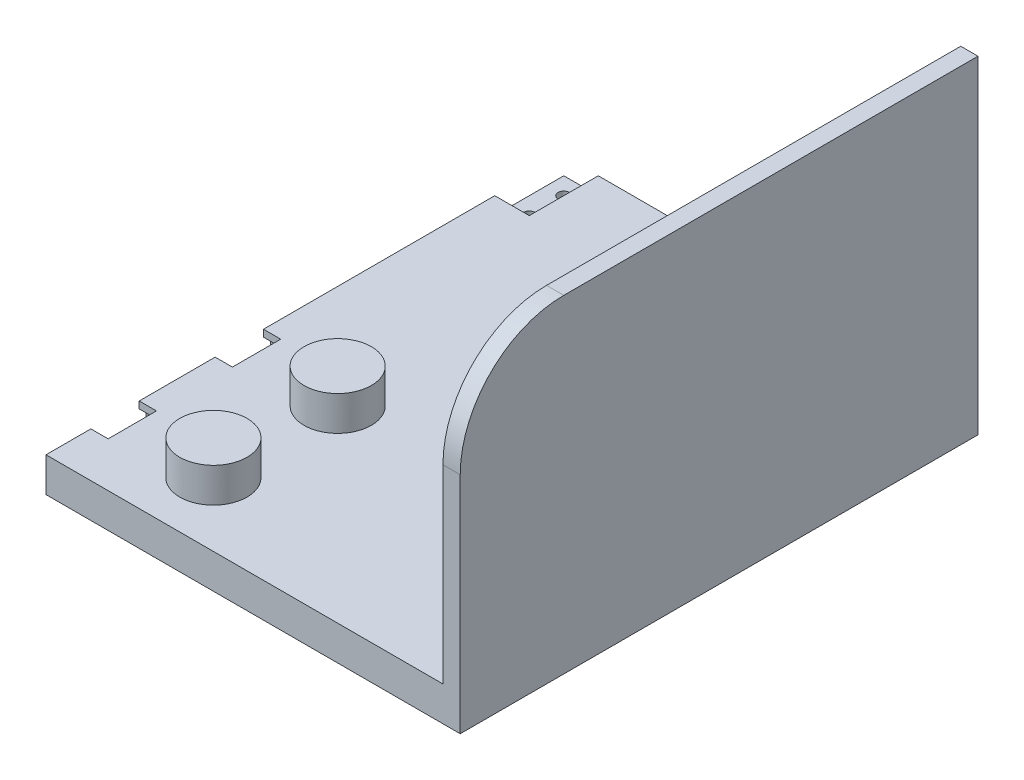
from build123d import *

# Parameters (mm, degrees)
SKETCH_1_W           = 120
SKETCH_1_H           = 95
EXTRUDE_1_DEPTH      = 150
SKETCH_2_W           = 115
SKETCH_2_H           = 85
CUT_EXTRUDE_1_DEPTH  = 150
CUT_EXTRUDE_2_DEPTH  = 150
SKETCH_5_W           = 10
SKETCH_5_H           = 35
SKETCH_5_R           = 1.65
EXTRUDE_2_DEPTH      = 5
EXTRUDE_START        = -33
EXTRUDE_3_DEPTH      = 3
EXTRUDE_START_2      = 52
EXTRUDE_4_DEPTH      = 3
SKETCH_8_W           = 10
SKETCH_8_H           = 20
SKETCH_8_R           = 1.65
CUT_EXTRUDE_3_DEPTH  = 5
SKETCH_10_R          = 1.65
CUT_EXTRUDE_4_DEPTH  = 195.788985905
SKETCH_22_R          = 7.75
CUT_EXTRUDE_8_DEPTH  = 199.407311022
SKETCH_24_R          = 9.75
SKETCH_24_R_2        = 7.75
EXTRUDE_7_DEPTH      = 15
SKETCH_26_R          = 9.75
EXTRUDE_8_DEPTH      = 5
SKETCH_31_W          = 40.5
SKETCH_31_H          = 21
CUT_EXTRUDE_11_DEPTH = 8
SKETCH_32_W          = 5
SKETCH_32_H          = 14
CUT_EXTRUDE_12_DEPTH = 200.355835204
SKETCH_33_W          = 55
SKETCH_33_H          = 55
CUT_EXTRUDE_13_DEPTH = 1
EXTRUDE_9_DEPTH      = 5


with BuildPart() as part:
    # 草图1 → 凸台-拉伸1 (new body)
    with BuildSketch(Plane.XY):
        with Locations((30.651801029, 11.329331046)):
            Rectangle(SKETCH_1_W, SKETCH_1_H)
    extrude(amount=EXTRUDE_1_DEPTH)

    # 草图2 → 切除-拉伸1 (cut)
    with BuildSketch(Plane.XY.offset(150)):
        with Locations((28.151801029, 16.329331046)):
            Rectangle(SKETCH_2_W, SKETCH_2_H)
    extrude(amount=-CUT_EXTRUDE_1_DEPTH, mode=Mode.SUBTRACT)

    # 草图3 → 切除-拉伸2 (cut)
    with BuildSketch(Plane(origin=(90.651801029, 0, 0), x_dir=(0, 0, -1), z_dir=(1, 0, 0))):
        Polygon((-150, 58.829331046), (-150, -26.170668954), (0, 58.829331046), align=None)
    extrude(amount=-CUT_EXTRUDE_2_DEPTH, mode=Mode.SUBTRACT)

    # 草图5 → 凸台-拉伸2 (add)
    with BuildSketch(Plane(origin=(0, 0, 0), x_dir=(-1, 0, 0), z_dir=(0, 0, -1))):
        with Locations((-80.651801029, 11.329331046)):
            Rectangle(SKETCH_5_W, SKETCH_5_H)
        with Locations((-80.651801029, 21.329331046)):
            Circle(SKETCH_5_R, mode=Mode.SUBTRACT)
        with Locations((-80.651801337, 11.329331046)):
            Circle(SKETCH_5_R, mode=Mode.SUBTRACT)
        with Locations((-80.651801337, 1.329331046)):
            Circle(SKETCH_5_R, mode=Mode.SUBTRACT)
    extrude(amount=-EXTRUDE_2_DEPTH)

    # 草图6 → 凸台-拉伸3 (add)
    with BuildSketch(Plane(origin=(0, -36.170668954, 0), x_dir=(-1, 0, 0), z_dir=(0, -1, 0)).offset(EXTRUDE_START)):
        Polygon((-85.651801029, -5), (-75.651801029, -5), (-85.651801029, -15), align=None)
    extrude(amount=EXTRUDE_3_DEPTH)

    # 草图7 → 凸台-拉伸4 (add)
    with BuildSketch(Plane(origin=(0, -26.170668954, 0), x_dir=(1, 0, 0), z_dir=(0, 1, 0)).offset(EXTRUDE_START_2)):
        Polygon((75.651801029, -5), (85.651801029, -5), (85.651801029, -15), align=None)
    extrude(amount=EXTRUDE_4_DEPTH)

    # 草图8 → 切除-拉伸3 (cut)
    with BuildSketch(Plane(origin=(0, -26.170668954, 0), x_dir=(1, 0, 0), z_dir=(0, 1, 0))):
        with Locations((-24.348198971, -10)):
            Rectangle(SKETCH_8_W, SKETCH_8_H)
        with Locations(Location((-24.348198971, -5, 0), (0, 0, 180))):
            Circle(SKETCH_8_R, mode=Mode.SUBTRACT)
        with Locations(Location((-24.348198971, -15, 0), (0, 0, 180))):
            Circle(SKETCH_8_R, mode=Mode.SUBTRACT)
    extrude(amount=-CUT_EXTRUDE_3_DEPTH, mode=Mode.SUBTRACT)

    # 草图10 → 切除-拉伸4 (cut, through all)
    with BuildSketch(Plane(origin=(0, -26.170668954, 0), x_dir=(1, 0, 0), z_dir=(0, 1, 0))):
        with Locations(Location((-24.348198971, -5, 0), (0, 0, 180))):
            Circle(SKETCH_10_R)
        with Locations(Location((-24.348198971, -15, 0), (0, 0, 180))):
            Circle(SKETCH_10_R)
    extrude(amount=-CUT_EXTRUDE_4_DEPTH, mode=Mode.SUBTRACT)

    # 草图22 → 切除-拉伸8 (cut, through all)
    with BuildSketch(Plane(origin=(76.451044211, -36.170668954, 11.627382734), x_dir=(-1, 0, 0), z_dir=(0, -1, 0))):
        with Locations(Location((75.799243182, -83.872617266, 0), (0, 0, 90))):
            Circle(SKETCH_22_R)
        with Locations(Location((75.799243182, -119.872617266, 0), (0, 0, 90))):
            Circle(SKETCH_22_R)
    extrude(amount=-CUT_EXTRUDE_8_DEPTH, mode=Mode.SUBTRACT)

    # 草图24 → 凸台-拉伸7 (add)
    # profile 1 of 2: a face of its own
    with BuildSketch(Plane(origin=(76.451044211, -36.170668954, 11.627382734), x_dir=(-1, 0, 0), z_dir=(0, -1, 0))):
        with Locations(Location((75.799243182, -83.872617266, 0), (0, 0, 90))):
            Circle(SKETCH_24_R)
        with Locations(Location((75.799243182, -83.872617266, 0), (0, 0, 90))):
            Circle(SKETCH_24_R_2, mode=Mode.SUBTRACT)
    # profile 2 of 2: a face of its own
    with BuildSketch(Plane(origin=(76.451044211, -36.170668954, 11.627382734), x_dir=(-1, 0, 0), z_dir=(0, -1, 0))):
        with Locations(Location((75.799243182, -119.872617266, 0), (0, 0, 90))):
            Circle(SKETCH_24_R)
        with Locations(Location((75.799243182, -119.872617266, 0), (0, 0, 90))):
            Circle(SKETCH_24_R_2, mode=Mode.SUBTRACT)
    extrude(amount=-EXTRUDE_7_DEPTH)

    # 草图26 → 凸台-拉伸8 (add)
    with BuildSketch(Plane(origin=(-76.451044211, -21.170668954, 11.627382734), x_dir=(1, 0, 0), z_dir=(0, 1, 0))):
        with Locations((77.10284524, -83.872617266)):
            Circle(SKETCH_26_R)
        with Locations((77.10284524, -119.872617266)):
            Circle(SKETCH_26_R)
    extrude(amount=EXTRUDE_8_DEPTH)

    # 草图31 → 切除-拉伸11 (cut)
    with BuildSketch(Plane.XZ.offset(36.170668954)):
        with Locations((-9.098198971, 131.5)):
            Rectangle(SKETCH_31_W, SKETCH_31_H)
        with Locations((-9.098198971, 95.5)):
            Rectangle(SKETCH_31_W, SKETCH_31_H)
    extrude(amount=-CUT_EXTRUDE_11_DEPTH, mode=Mode.SUBTRACT)

    # 草图32 → 切除-拉伸12 (cut, through all)
    with BuildSketch(Plane.XZ.offset(36.170668954)):
        with Locations((-26.848198971, 130)):
            Rectangle(SKETCH_32_W, SKETCH_32_H)
        with Locations((-26.848198971, 94)):
            Rectangle(SKETCH_32_W, SKETCH_32_H)
    extrude(amount=-CUT_EXTRUDE_12_DEPTH, mode=Mode.SUBTRACT)

    # 草图33 → 切除-拉伸13 (cut)
    with BuildSketch(Plane.XZ.offset(36.170668954)):
        with Locations((58.151801029, 117.5)):
            Rectangle(SKETCH_33_W, SKETCH_33_H)
    extrude(amount=-CUT_EXTRUDE_13_DEPTH, mode=Mode.SUBTRACT)

    # 草图34 → 凸台-拉伸9 (add)
    with BuildSketch(Plane(origin=(90.651801029, 0, 0), x_dir=(0, 0, -1), z_dir=(1, 0, 0))):
        with BuildLine():
            Line((-150, -26.170668954), (-150, 28.829331046))
            ThreePointArc((-150, 28.829331046), (-141.213203436, 50.042534482), (-120, 58.829331046))
            Line((-120, 58.829331046), (0, 58.829331046))
            Line((0, 58.829331046), (-150, -26.170668954))
        make_face()
    extrude(amount=-EXTRUDE_9_DEPTH)


solid = part.part
